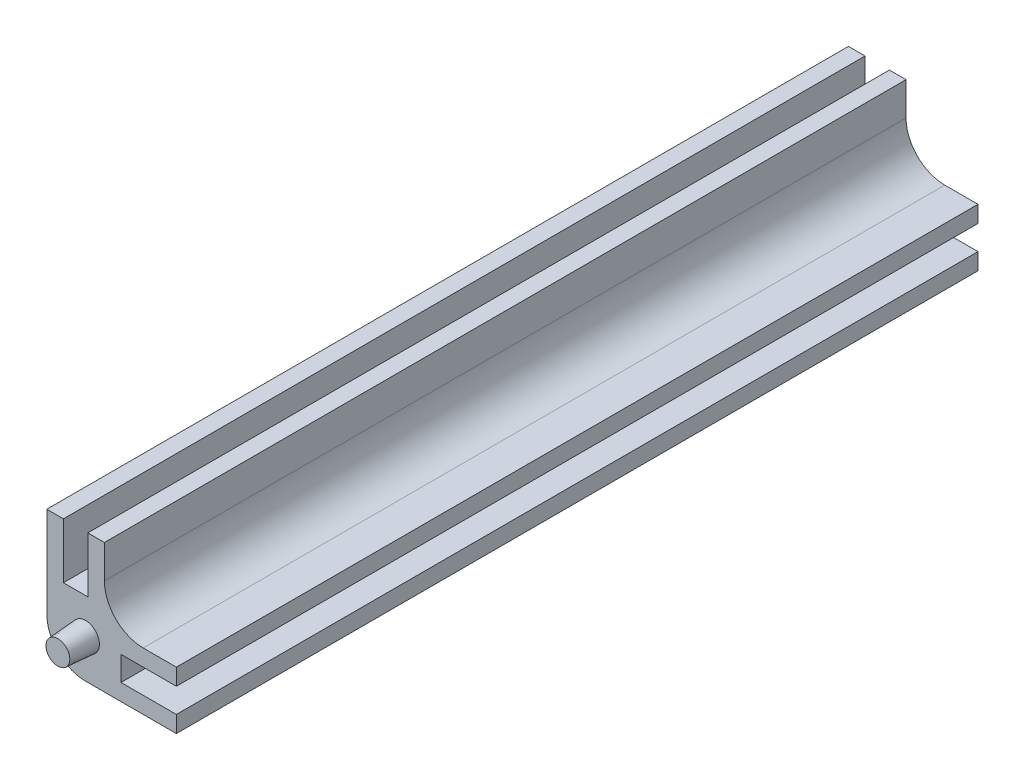
from build123d import *

# Parameters (mm, degrees)
EXTRUDE1_DEPTH     = 144.8
SKETCH2_R          = 2.5
EXTRUDE2_DEPTH     = 5
EXTRUDE2_TAPER     = 4
SKETCH3_R          = 2.6
CUT_EXTRUDE1_DEPTH = 5.2
CUT_EXTRUDE1_DRAFT = -3.8


with BuildPart() as part:
    # Sketch1 → Extrude1 (new body)
    with BuildSketch(Plane.XY):
        with BuildLine():
            Line((-3.4, -10.4), (13, -10.4))
            Line((13, -10.4), (13, -7.4))
            Line((13, -7.4), (3, -7.4))
            Line((3, -7.4), (3, -3))
            Line((3, -3), (13, -3))
            Line((13, -3), (13, 0))
            Line((13, 0), (7, 0))
            ThreePointArc((7, 0), (2.050252532, 2.050252532), (0, 7))
            Line((0, 7), (0, 13))
            Line((0, 13), (-3, 13))
            Line((-3, 13), (-3, 3))
            Line((-3, 3), (-7.4, 3))
            Line((-7.4, 3), (-7.4, 13))
            Line((-7.4, 13), (-10.4, 13))
            Line((-10.4, 13), (-10.4, -3.4))
            ThreePointArc((-10.4, -3.4), (-8.349747468, -8.349747468), (-3.4, -10.4))
        make_face()
    extrude(amount=EXTRUDE1_DEPTH)

    # Sketch2 → Extrude2 (add)
    with BuildSketch(Plane.XY.offset(144.8)):
        with Locations((-3.4, -3.4)):
            Circle(SKETCH2_R)
    extrude(amount=EXTRUDE2_DEPTH, taper=EXTRUDE2_TAPER)


with BuildPart() as cut_extrude1_tool:
    # Sketch3 → Cut-Extrude1 (with draft: the straight prism first)
    with BuildSketch(Plane(origin=(0, 0, 0), x_dir=(-1, 0, 0), z_dir=(0, 0, -1))):
        with Locations((3.4, -3.4)):
            Circle(SKETCH3_R)
    extrude(amount=-CUT_EXTRUDE1_DEPTH)
    # Cut-Extrude1: the draft: its side faces are tilted about the plane it starts from
    cut_extrude1_sides = [cut_extrude1_tool.faces().sort_by_distance(p)[0] for p in [
        (-0.8, -3.4, 2.6),
    ]]
    draft(cut_extrude1_sides, Plane(origin=(0, 0, 0), x_dir=(-1, 0, 0), z_dir=(0, 0, -1)), CUT_EXTRUDE1_DRAFT)


with BuildPart() as part_1:
    add(part.part)

    # Cut-Extrude1: cut by cut_extrude1_tool
    add(cut_extrude1_tool.part, mode=Mode.SUBTRACT)


solid = part_1.part
